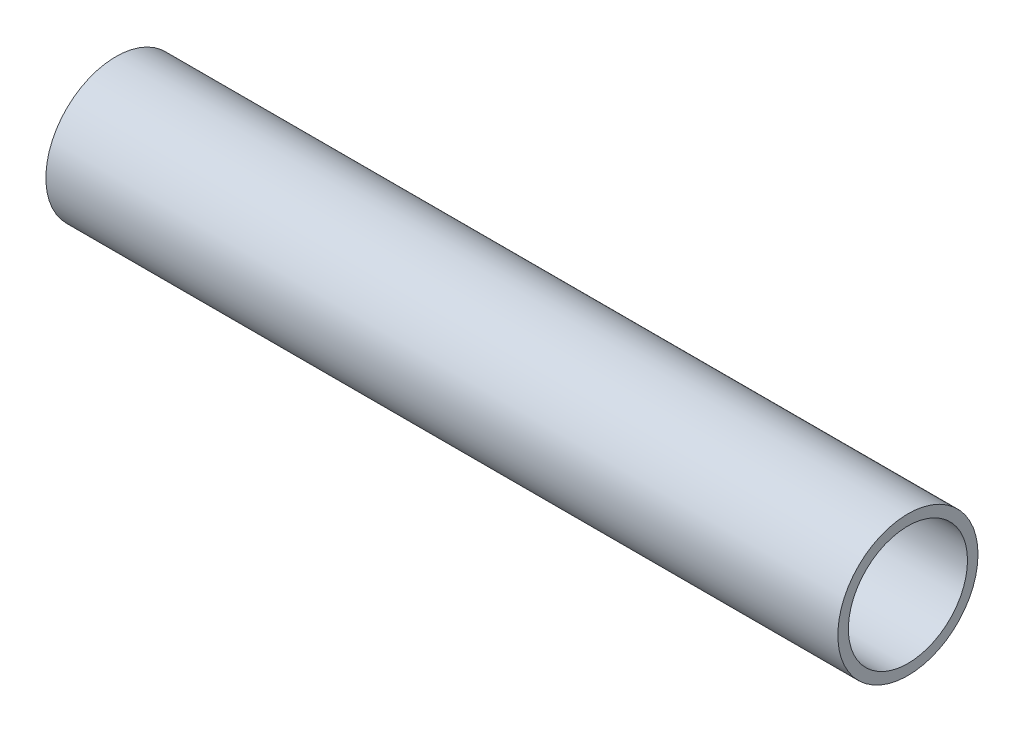
from build123d import *

# Parameters (mm, degrees)
SKETCH_1_R      = 10
SKETCH_1_R_2    = 8.5
EXTRUDE_1_DEPTH = 113


with BuildPart() as part:
    # 草图1 → 凸台-拉伸1 (new body)
    with BuildSketch(Plane(origin=(0, 0, 0), x_dir=(0, 0, -1), z_dir=(1, 0, 0))):
        Circle(SKETCH_1_R)
        Circle(SKETCH_1_R_2, mode=Mode.SUBTRACT)
    extrude(amount=EXTRUDE_1_DEPTH)


solid = part.part
